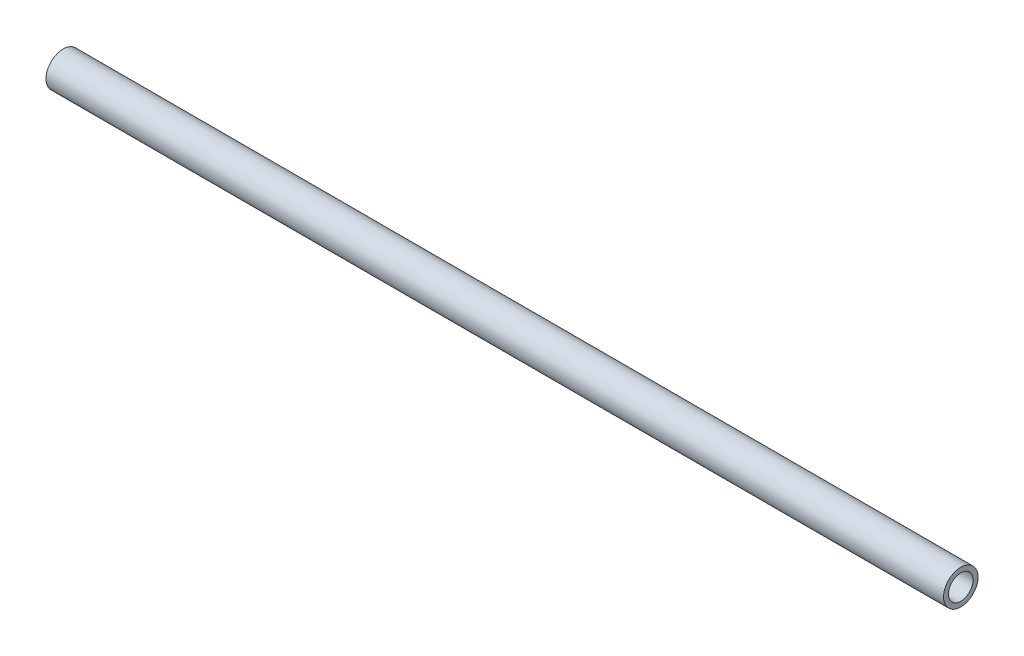
from build123d import *

# Parameters (mm, degrees)
SKETCH5_R           = 22.2504
SKETCH5_R_2         = 15.875
EXTRUDE_THIN1_DEPTH = 579.12


with BuildPart() as part:
    # Sketch5 → Extrude-Thin1 (new, symmetric)
    with BuildSketch(Plane(origin=(0, 0, 0), x_dir=(0, 0, -1), z_dir=(1, 0, 0))):
        Circle(SKETCH5_R)
        Circle(SKETCH5_R_2, mode=Mode.SUBTRACT)
    extrude(amount=EXTRUDE_THIN1_DEPTH, both=True)


solid = part.part
